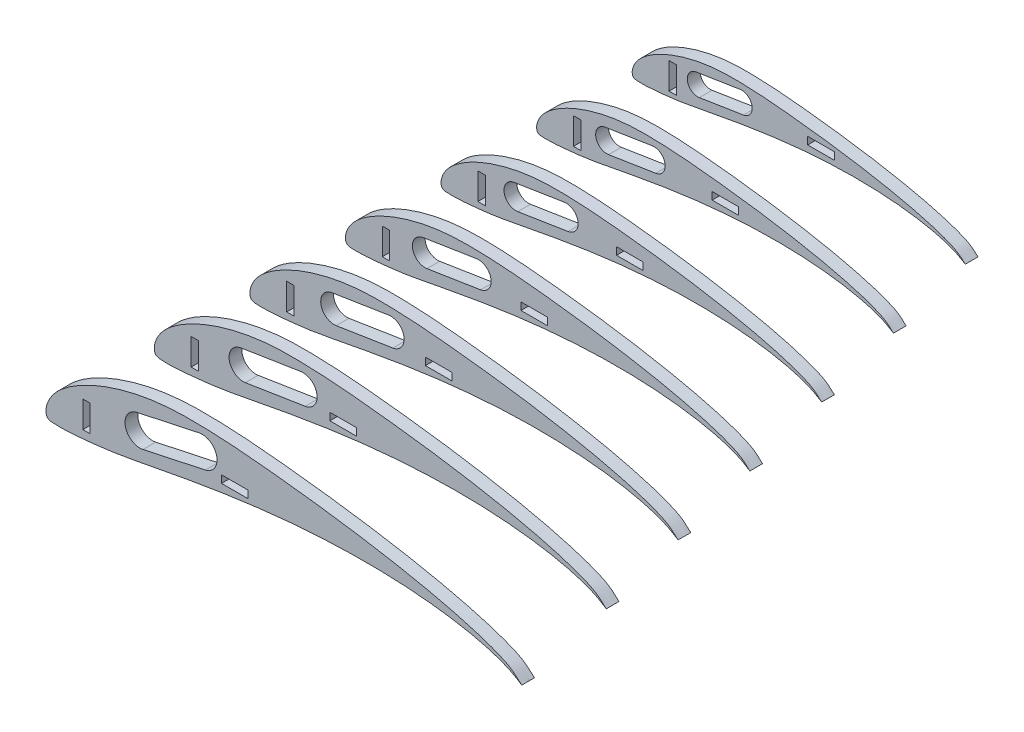
from build123d import *

# Parameters (mm, degrees)
BOSS_EXTRUDE1_DEPTH  = 6
CUT_EXTRUDE1_DEPTH   = 10
BOSS_EXTRUDE8_DEPTH  = 6
BOSS_EXTRUDE9_DEPTH  = 6
BOSS_EXTRUDE10_DEPTH = 6
BOSS_EXTRUDE11_DEPTH = 6
BOSS_EXTRUDE12_DEPTH = 6
BOSS_EXTRUDE13_DEPTH = 6
SKETCH11_W           = 3.5
SKETCH11_H           = 12.5
SKETCH11_W_2         = 12.5
SKETCH11_H_2         = 3.5
CUT_EXTRUDE2_DEPTH   = 362.412187266


with BuildPart() as part:
    # Sketch2 → Boss-Extrude1 (new body)
    with BuildSketch(Plane(origin=(0, 0, 0), x_dir=(0, 1, 0), z_dir=(0, 0, 1))):
        with BuildLine():
            add(Edge.make_bspline(
                [(0, -224), (0.005702412, -224.001341001), (0.554348448, -223.264970695), (1.165388694, -222.642205802), (2.44166658, -221.259416175), (3.799382204, -219.628047718), (5.168110619, -217.396475791), (6.494563188, -214.621499139), (7.878877108, -211.271449243), (9.301777091, -207.351432564), (10.753211404, -202.87973715), (12.220578138, -197.879577131), (13.696990178, -192.37895201), (15.168891242, -186.408233862), (16.625626309, -180.001654372), (18.058096621, -173.197398334), (19.458938187, -166.037015691), (20.810912823, -158.562355663), (22.112088945, -150.820487592), (23.34571141, -142.856028479), (24.514189105, -134.720484688), (25.60826243, -126.465995343), (26.624430408, -118.152347749), (27.56988806, -109.846003212), (28.420779048, -101.615725894), (29.161177978, -93.528566604), (29.749411157, -85.64140381), (30.154040087, -77.999291883), (30.328777712, -70.644746389), (30.310178033, -63.615443619), (29.966002817, -56.924495942), (29.268547246, -50.569311468), (28.282334726, -44.524019662), (27.004705112, -38.787161488), (25.50650617, -33.364630731), (23.814273297, -28.279370788), (21.967579419, -23.553008802), (19.976318444, -19.214914939), (17.880918697, -15.279001261), (15.705208923, -11.76668043), (13.478671875, -8.699978573), (11.2485017, -6.08016101), (8.990354416, -3.945219698), (6.723785626, -2.305312453), (4.518716045, -1.093954275), (2.42510695, -0.317601878), (0.492706389, 0.052330076), (-1.141646455, -0.019076802), (-2.640611366, -0.439847315), (-3.384708529, -2.003918685), (-3.489103018, -4.106833179), (-3.590282567, -6.983612367), (-3.434277467, -10.601365227), (-3.147587635, -14.919204004), (-2.688372693, -19.88907566), (-2.067035131, -25.460124636), (-1.270242167, -31.605185034), (-0.15660544, -38.321253852), (1.239876963, -45.641031053), (2.759695447, -53.601110597), (4.364405875, -62.162584264), (5.98740184, -71.271676995), (7.567774206, -80.861491288), (9.052750205, -90.857628696), (10.387855574, -101.173942968), (11.534215269, -111.717662379), (12.440365405, -122.389187836), (13.082714119, -133.081427951), (13.435848787, -143.682676261), (13.480452226, -154.077927826), (13.21349384, -164.151207334), (12.641223178, -173.787169766), (11.771024072, -182.869944039), (10.636299016, -191.291394287), (9.269973456, -198.941875925), (7.717807326, -205.731690442), (6.056920419, -211.535704676), (4.284278527, -216.285691763), (2.662084252, -219.674685277), (1.162148937, -222.173299724), (0.581698714, -223.13315995), (-0.005818341, -223.998631736), (0, -224)],
                knots=[0, 0, 0, 0, 0.000979678, 0.003648862, 0.007483499, 0.012095277, 0.017525591, 0.02405178, 0.031783051, 0.040677828, 0.050710301, 0.061833229, 0.07398925, 0.087118173, 0.101145049, 0.115990637, 0.131570422, 0.147788379, 0.164550917, 0.181757895, 0.199311955, 0.217095072, 0.234990228, 0.252856883, 0.270540594, 0.287886779, 0.304773438, 0.321101419, 0.336806063, 0.351800033, 0.366031063, 0.379615675, 0.392652963, 0.405170359, 0.417171919, 0.428603517, 0.439418959, 0.449596586, 0.459102079, 0.467907878, 0.475988301, 0.483308969, 0.489874508, 0.49580325, 0.501149412, 0.505903073, 0.510046769, 0.513579311, 0.516446927, 0.519350053, 0.523823355, 0.529973794, 0.537715654, 0.546967844, 0.557637367, 0.569620481, 0.582804124, 0.597246961, 0.613135037, 0.6304436, 0.649056124, 0.668822257, 0.689594964, 0.711189651, 0.733426689, 0.756094118, 0.778988554, 0.801889683, 0.824566598, 0.846792285, 0.868338291, 0.888978163, 0.908492011, 0.926658768, 0.943286193, 0.95816921, 0.971135822, 0.981955623, 0.990251791, 0.995852565, 0.999000406, 1, 1, 1, 1], degree=3))
        make_face()
    extrude(amount=BOSS_EXTRUDE1_DEPTH)

    # Sketch3 → Cut-Extrude1 (cut)
    with BuildSketch(Plane(origin=(0, 0, 0), x_dir=(1, 0, 0), z_dir=(0, 0, -1))):
        with BuildLine():
            Line((45.664943608, -6.8980064), (74.995985185, -13.1980064))
            ThreePointArc((74.995985185, -13.1980064), (80.369894886, -21.511916101), (72.055985185, -26.885825803))
            Line((72.055985185, -26.885825803), (42.724943608, -20.585825803))
            ThreePointArc((42.724943608, -20.585825803), (37.351033906, -12.271916101), (45.664943608, -6.8980064))
        make_face()
    extrude(amount=-CUT_EXTRUDE1_DEPTH, mode=Mode.SUBTRACT)


with BuildPart() as body_2:
    # Sketch5 → Boss-Extrude8 (new body)
    with BuildSketch(Plane(origin=(0, 0, -45), x_dir=(-1, 0, 0), z_dir=(0, 0, -1))):
        with BuildLine():
            add(Edge.make_bspline(
                [(-212.8, 0), (-212.79870015, -0.005527424), (-211.976501953, 0.552613778), (-211.064634738, 1.10404149), (-208.690951013, 2.528980039), (-205.471407175, 4.0700646), (-200.958919443, 5.754074398), (-195.44510592, 7.33191696), (-188.994782128, 8.806474783), (-181.726824573, 10.104484065), (-173.726446837, 11.182472868), (-165.097811278, 12.009162019), (-155.943646967, 12.552819148), (-146.374031435, 12.806429614), (-136.498542448, 12.764056347), (-126.427356553, 12.428578413), (-116.269728444, 11.818347135), (-106.13177926, 10.957504505), (-96.115245819, 9.868462796), (-86.314747261, 8.600112694), (-76.818416723, 7.189385496), (-67.708093146, 5.688031748), (-59.054455051, 4.146185582), (-50.921055067, 2.621710675), (-43.3589795, 1.177883115), (-36.405191159, -0.148775168), (-30.024925782, -1.206730058), (-24.187118405, -1.963683374), (-18.894621877, -2.553954058), (-14.173243804, -2.990208253), (-10.071296965, -3.262563593), (-6.634431749, -3.410768438), (-3.90149152, -3.314647867), (-1.90372275, -3.215473103), (-0.417854949, -2.508580798), (-0.018122962, -1.084564133), (0.049713573, 0.46807107), (-0.301721784, 2.303851603), (-1.039256561, 4.292780243), (-2.190046831, 6.387596345), (-3.747958713, 8.540836695), (-5.77615296, 10.686076615), (-8.264979645, 12.804738281), (-11.178346408, 14.919948477), (-14.515051198, 16.986872762), (-18.254169192, 18.977502521), (-22.375358362, 20.869200448), (-26.865402249, 22.623559632), (-31.696399194, 24.231180862), (-36.847803413, 25.654469857), (-42.297818679, 26.86821799), (-48.040845894, 27.805119884), (-54.078271145, 28.467702677), (-60.434671438, 28.794669132), (-67.11250907, 28.812338826), (-74.099327289, 28.646338083), (-81.359333619, 28.261940599), (-88.852138273, 27.703119079), (-96.534939599, 26.999740095), (-104.353703051, 26.191393657), (-112.244730361, 25.293208887), (-120.142695576, 24.327849308), (-127.984460453, 23.28847965), (-135.713227055, 22.178425839), (-143.279463212, 21.006484498), (-150.63423788, 19.770367182), (-157.735164906, 18.485991277), (-164.537528417, 17.15519179), (-171.001571654, 15.794344994), (-177.087822169, 14.41044668), (-182.76000441, 13.012140669), (-187.985598274, 11.609549231), (-192.735750292, 10.215550833), (-196.983860936, 8.836688236), (-200.707876781, 7.484933253), (-203.890424182, 6.169835028), (-206.526652002, 4.909705088), (-208.646645332, 3.609413094), (-210.196445366, 2.319583251), (-211.510095512, 1.107119259), (-212.10172216, 0.526631026), (-212.801273951, 0.005417291), (-212.8, 0)],
                knots=[0, 0, 0, 0, 0.000999594, 0.004147435, 0.009748209, 0.018044377, 0.028864178, 0.04183079, 0.056713807, 0.073341232, 0.091507989, 0.111021837, 0.131661709, 0.153207715, 0.175433402, 0.198110317, 0.221011446, 0.243905882, 0.266573311, 0.288810349, 0.310405036, 0.331177743, 0.350943876, 0.3695564, 0.386864963, 0.402753039, 0.417195876, 0.430379519, 0.442362633, 0.453032156, 0.462284346, 0.470026206, 0.476176645, 0.480649947, 0.483553073, 0.486420689, 0.489953231, 0.494096927, 0.498850588, 0.50419675, 0.510125492, 0.516691031, 0.524011699, 0.532092122, 0.540897921, 0.550403414, 0.560581041, 0.571396483, 0.582828081, 0.594829641, 0.607347037, 0.620384325, 0.633968937, 0.648199967, 0.663193937, 0.678898581, 0.695226562, 0.712113221, 0.729459406, 0.747143117, 0.765009772, 0.782904928, 0.800688045, 0.818242105, 0.835449083, 0.852211621, 0.868429578, 0.884009363, 0.898854951, 0.912881827, 0.92601075, 0.938166771, 0.949289699, 0.959322172, 0.968216949, 0.97594822, 0.982474409, 0.987904723, 0.992516501, 0.996351138, 0.999020322, 1, 1, 1, 1], degree=3))
        make_face()
        with BuildLine():
            Line((-40.804637579, 20.393372232), (-68.955851175, 24.838501372))
            ThreePointArc((-68.955851175, 24.838501372), (-76.56166448, 19.307081666), (-71.030244774, 11.701268361))
            Line((-71.030244774, 11.701268361), (-42.879031178, 7.25613922))
            ThreePointArc((-42.879031178, 7.25613922), (-35.273217873, 12.787558927), (-40.804637579, 20.393372232))
        make_face(mode=Mode.SUBTRACT)
    extrude(amount=BOSS_EXTRUDE8_DEPTH)


with BuildPart() as body_3:
    # Sketch6 → Boss-Extrude9 (new body)
    with BuildSketch(Plane(origin=(0, 0, -90), x_dir=(-1, 0, 0), z_dir=(0, 0, -1))):
        with BuildLine():
            add(Edge.make_bspline(
                [(-201.6, 0), (-201.598768563, -0.005236507), (-200.819843955, 0.523528843), (-199.955969751, 1.045934044), (-197.707216749, 2.395875827), (-194.657122586, 3.855850674), (-190.382134209, 5.451228377), (-185.158521398, 6.946026594), (-179.047688332, 8.34297611), (-172.162254859, 9.572669115), (-164.582949635, 10.593921664), (-156.408452789, 11.37710086), (-147.7360866, 11.892144456), (-138.670135043, 12.132407003), (-129.314408635, 12.092263908), (-119.773285155, 11.774442707), (-110.150269052, 11.196328865), (-100.545896141, 10.380793742), (-91.056548671, 9.349070017), (-81.771865826, 8.147475184), (-72.775342159, 6.810996786), (-64.144509296, 5.388661656), (-55.946325838, 3.927965288), (-48.240999537, 2.483725902), (-41.076927948, 1.115889267), (-34.489128466, -0.140944896), (-28.44466653, -1.14321795), (-22.914112173, -1.860331618), (-17.900168094, -2.419535423), (-13.427283603, -2.832828872), (-9.541228704, -3.09084972), (-6.285251131, -3.23125431), (-3.696149861, -3.140192716), (-1.803526816, -3.046237676), (-0.395862583, -2.37655023), (-0.017169122, -1.02748181), (0.047097069, 0.44343575), (-0.28584169, 2.182596255), (-0.984558847, 4.06684444), (-2.074781208, 6.051407064), (-3.550697728, 8.091318975), (-5.472144909, 10.12365153), (-7.829980716, 12.130804687), (-10.590012387, 14.134688031), (-13.751101135, 16.092826828), (-17.293423446, 17.978686599), (-21.197707922, 19.770821477), (-25.451433709, 21.432845967), (-30.028167658, 22.955855553), (-34.908445339, 24.304234601), (-40.071617695, 25.454101254), (-45.512380321, 26.341692522), (-51.232046348, 26.969402536), (-57.253899257, 27.27916023), (-63.58027175, 27.295899941), (-70.199362695, 27.138636078), (-77.077263429, 26.774470041), (-84.175709943, 26.245060181), (-91.454153304, 25.578701143), (-98.861402891, 24.812899254), (-106.337112974, 23.961987367), (-113.819395809, 23.047436187), (-121.248436219, 22.062770195), (-128.570425631, 21.011140269), (-135.738438833, 19.900880051), (-142.706120097, 18.72982154), (-149.433314122, 17.513044368), (-155.877658501, 16.252286959), (-162.001488935, 14.963063678), (-167.767410476, 13.652002118), (-173.141056809, 12.32729116), (-178.091619418, 10.998520324), (-182.591763435, 9.677890263), (-186.616289308, 8.371599382), (-190.144304319, 7.090989397), (-193.159349225, 5.845106869), (-195.656828212, 4.651299557), (-197.665242946, 3.419443984), (-199.133474557, 2.197499922), (-200.377985222, 1.048849825), (-200.938473626, 0.498913603), (-201.601206901, 0.005132171), (-201.6, 0)],
                knots=[0, 0, 0, 0, 0.000999594, 0.004147435, 0.009748209, 0.018044377, 0.028864178, 0.04183079, 0.056713807, 0.073341232, 0.091507989, 0.111021837, 0.131661709, 0.153207715, 0.175433402, 0.198110317, 0.221011446, 0.243905882, 0.266573311, 0.288810349, 0.310405036, 0.331177743, 0.350943876, 0.3695564, 0.386864963, 0.402753039, 0.417195876, 0.430379519, 0.442362633, 0.453032156, 0.462284346, 0.470026206, 0.476176645, 0.480649947, 0.483553073, 0.486420689, 0.489953231, 0.494096927, 0.498850588, 0.50419675, 0.510125492, 0.516691031, 0.524011699, 0.532092122, 0.540897921, 0.550403414, 0.560581041, 0.571396483, 0.582828081, 0.594829641, 0.607347037, 0.620384325, 0.633968937, 0.648199967, 0.663193937, 0.678898581, 0.695226562, 0.712113221, 0.729459406, 0.747143117, 0.765009772, 0.782904928, 0.800688045, 0.818242105, 0.835449083, 0.852211621, 0.868429578, 0.884009363, 0.898854951, 0.912881827, 0.92601075, 0.938166771, 0.949289699, 0.959322172, 0.968216949, 0.97594822, 0.982474409, 0.987904723, 0.992516501, 0.996351138, 0.999020322, 1, 1, 1, 1], degree=3))
        make_face()
        with BuildLine():
            Line((-38.657025075, 19.320036851), (-65.32659585, 23.531211826))
            ThreePointArc((-65.32659585, 23.531211826), (-72.532103192, 18.290919473), (-67.291810839, 11.085412131))
            Line((-67.291810839, 11.085412131), (-40.622240063, 6.874237156))
            ThreePointArc((-40.622240063, 6.874237156), (-33.416732722, 12.114529509), (-38.657025075, 19.320036851))
        make_face(mode=Mode.SUBTRACT)
    extrude(amount=BOSS_EXTRUDE9_DEPTH)


with BuildPart() as body_4:
    # Sketch7 → Boss-Extrude10 (new body)
    with BuildSketch(Plane(origin=(0, 0, -135), x_dir=(-1, 0, 0), z_dir=(0, 0, -1))):
        with BuildLine():
            add(Edge.make_bspline(
                [(-190.4, 0), (-190.398836976, -0.00494559), (-189.663185958, 0.494443907), (-188.847304765, 0.987826597), (-186.723482486, 2.262771614), (-183.842837998, 3.641636748), (-179.805348975, 5.148382356), (-174.871936876, 6.560136228), (-169.100594536, 7.879477437), (-162.597685144, 9.040854164), (-155.439452433, 10.005370461), (-147.719094301, 10.745039701), (-139.528526234, 11.231469764), (-130.966238652, 11.458384392), (-122.130274822, 11.420471469), (-113.119213758, 11.120307001), (-104.03080966, 10.574310595), (-94.960013022, 9.804082978), (-85.997851523, 8.829677238), (-77.228984391, 7.694837674), (-68.732267595, 6.432608075), (-60.580925446, 5.089291564), (-52.838196625, 3.709744994), (-45.560944008, 2.34574113), (-38.794876395, 1.053895418), (-32.573065774, -0.133114624), (-26.864407279, -1.079705842), (-21.641105941, -1.756979861), (-16.905714311, -2.285116789), (-12.681323403, -2.67544949), (-9.011160443, -2.919135847), (-5.936070512, -3.051740182), (-3.490808202, -2.965737565), (-1.703330882, -2.87700225), (-0.373870217, -2.244519661), (-0.016215282, -0.970399487), (0.044480565, 0.418800431), (-0.269961596, 2.061340908), (-0.929861134, 3.840908638), (-1.959515585, 5.715217782), (-3.353436743, 7.641801254), (-5.168136859, 9.561226445), (-7.394981787, 11.456871094), (-10.001678365, 13.349427584), (-12.987151072, 15.198780893), (-16.332677699, 16.979870677), (-20.020057482, 18.672442506), (-24.03746517, 20.242132302), (-28.359936121, 21.680530245), (-32.969087264, 22.953999346), (-37.845416712, 24.039984517), (-42.983914747, 24.878265159), (-48.385821551, 25.471102395), (-54.073127076, 25.763651328), (-60.048034431, 25.779461055), (-66.2993981, 25.630934074), (-72.795193238, 25.286999483), (-79.499281613, 24.787001282), (-86.37336701, 24.15766219), (-93.36910273, 23.434404851), (-100.429495586, 22.630765847), (-107.496096041, 21.767023065), (-114.512411985, 20.83706074), (-121.427624207, 19.843854698), (-128.197414453, 18.795275603), (-134.778002314, 17.689275899), (-141.131463337, 16.540097459), (-147.217788584, 15.349382128), (-153.001406217, 14.131782363), (-158.446998783, 12.893557556), (-163.522109209, 11.642441651), (-168.197640561, 10.387491417), (-172.447776577, 9.140229693), (-176.24871768, 7.906510527), (-179.580731857, 6.697045542), (-182.428274268, 5.520378709), (-184.787004422, 4.392894026), (-186.68384056, 3.229474874), (-188.070503749, 2.075416593), (-189.245874932, 0.99058039), (-189.775225091, 0.471196181), (-190.401139851, 0.00484705), (-190.4, 0)],
                knots=[0, 0, 0, 0, 0.000999594, 0.004147435, 0.009748209, 0.018044377, 0.028864178, 0.04183079, 0.056713807, 0.073341232, 0.091507989, 0.111021837, 0.131661709, 0.153207715, 0.175433402, 0.198110317, 0.221011446, 0.243905882, 0.266573311, 0.288810349, 0.310405036, 0.331177743, 0.350943876, 0.3695564, 0.386864963, 0.402753039, 0.417195876, 0.430379519, 0.442362633, 0.453032156, 0.462284346, 0.470026206, 0.476176645, 0.480649947, 0.483553073, 0.486420689, 0.489953231, 0.494096927, 0.498850588, 0.50419675, 0.510125492, 0.516691031, 0.524011699, 0.532092122, 0.540897921, 0.550403414, 0.560581041, 0.571396483, 0.582828081, 0.594829641, 0.607347037, 0.620384325, 0.633968937, 0.648199967, 0.663193937, 0.678898581, 0.695226562, 0.712113221, 0.729459406, 0.747143117, 0.765009772, 0.782904928, 0.800688045, 0.818242105, 0.835449083, 0.852211621, 0.868429578, 0.884009363, 0.898854951, 0.912881827, 0.92601075, 0.938166771, 0.949289699, 0.959322172, 0.968216949, 0.97594822, 0.982474409, 0.987904723, 0.992516501, 0.996351138, 0.999020322, 1, 1, 1, 1], degree=3))
        make_face()
        with BuildLine():
            Line((-36.509412571, 18.24670147), (-61.697340525, 22.22392228))
            ThreePointArc((-61.697340525, 22.22392228), (-68.502541903, 17.27475728), (-63.553376903, 10.469555902))
            Line((-63.553376903, 10.469555902), (-38.365448949, 6.492335092))
            ThreePointArc((-38.365448949, 6.492335092), (-31.56024757, 11.441500092), (-36.509412571, 18.24670147))
        make_face(mode=Mode.SUBTRACT)
    extrude(amount=BOSS_EXTRUDE10_DEPTH)


with BuildPart() as body_5:
    # Sketch8 → Boss-Extrude11 (new body)
    with BuildSketch(Plane(origin=(0, 0, -180), x_dir=(-1, 0, 0), z_dir=(0, 0, -1))):
        with BuildLine():
            add(Edge.make_bspline(
                [(-179.2, 0), (-179.198905389, -0.004654673), (-178.50652796, 0.465358971), (-177.738639779, 0.92971915), (-175.739748222, 2.129667402), (-173.02855341, 3.427422821), (-169.228563741, 4.845536335), (-164.585352354, 6.174245861), (-159.15350074, 7.415978765), (-153.03311543, 8.509039213), (-146.295955231, 9.416819257), (-139.029735813, 10.112978542), (-131.320965867, 10.570795072), (-123.262342261, 10.78436178), (-114.946141009, 10.748679029), (-106.46514236, 10.466171295), (-97.911350268, 9.952292324), (-89.374129903, 9.227372215), (-80.939154374, 8.310284459), (-72.686102957, 7.242200164), (-64.68919303, 6.054219365), (-57.017341596, 4.789921472), (-49.730067411, 3.4915247), (-42.880888478, 2.207756358), (-36.512824842, 0.99190157), (-30.657003081, -0.125284352), (-25.284148027, -1.016193733), (-20.368099709, -1.653628105), (-15.911260528, -2.150698154), (-11.935363203, -2.518070108), (-8.481092181, -2.747421973), (-5.586889894, -2.872226053), (-3.285466543, -2.791282414), (-1.603134948, -2.707766823), (-0.351877852, -2.112489093), (-0.015261442, -0.913317164), (0.041864061, 0.394165111), (-0.254081503, 1.94008556), (-0.87516342, 3.614972836), (-1.844249963, 5.379028501), (-3.156175758, 7.192283533), (-4.864128808, 8.99880136), (-6.959982859, 10.7829375), (-9.413344344, 12.564167138), (-12.223201009, 14.304734958), (-15.371931952, 15.981054755), (-18.842407042, 17.574063535), (-22.623496631, 19.051418638), (-26.691704584, 20.405204936), (-31.02972919, 21.60376409), (-35.619215729, 22.625867781), (-40.455449174, 23.414837797), (-45.539596754, 23.972802254), (-50.892354895, 24.248142427), (-56.515797111, 24.26302217), (-62.399433506, 24.12323207), (-68.513123048, 23.799528926), (-74.822853283, 23.328942383), (-81.292580715, 22.736623238), (-87.87680257, 22.055910448), (-94.521878199, 21.299544326), (-101.172796274, 20.486609944), (-107.77638775, 19.611351284), (-114.284822783, 18.676569128), (-120.656390074, 17.689671156), (-126.849884531, 16.648730258), (-132.829612552, 15.567150549), (-138.557918667, 14.446477297), (-144.001323498, 13.300501047), (-149.12658709, 12.135112994), (-153.903161608, 10.957592142), (-158.303661705, 9.77646251), (-162.30378972, 8.602569123), (-165.881146051, 7.441421672), (-169.017159395, 6.303101686), (-171.697199311, 5.19565055), (-173.917180633, 4.134488495), (-175.702438174, 3.039505764), (-177.00753294, 1.953333264), (-178.113764642, 0.932310955), (-178.611976556, 0.443478758), (-179.201072801, 0.004561929), (-179.2, 0)],
                knots=[0, 0, 0, 0, 0.000999594, 0.004147435, 0.009748209, 0.018044377, 0.028864178, 0.04183079, 0.056713807, 0.073341232, 0.091507989, 0.111021837, 0.131661709, 0.153207715, 0.175433402, 0.198110317, 0.221011446, 0.243905882, 0.266573311, 0.288810349, 0.310405036, 0.331177743, 0.350943876, 0.3695564, 0.386864963, 0.402753039, 0.417195876, 0.430379519, 0.442362633, 0.453032156, 0.462284346, 0.470026206, 0.476176645, 0.480649947, 0.483553073, 0.486420689, 0.489953231, 0.494096927, 0.498850588, 0.50419675, 0.510125492, 0.516691031, 0.524011699, 0.532092122, 0.540897921, 0.550403414, 0.560581041, 0.571396483, 0.582828081, 0.594829641, 0.607347037, 0.620384325, 0.633968937, 0.648199967, 0.663193937, 0.678898581, 0.695226562, 0.712113221, 0.729459406, 0.747143117, 0.765009772, 0.782904928, 0.800688045, 0.818242105, 0.835449083, 0.852211621, 0.868429578, 0.884009363, 0.898854951, 0.912881827, 0.92601075, 0.938166771, 0.949289699, 0.959322172, 0.968216949, 0.97594822, 0.982474409, 0.987904723, 0.992516501, 0.996351138, 0.999020322, 1, 1, 1, 1], degree=3))
        make_face()
        with BuildLine():
            Line((-34.361800067, 17.17336609), (-58.0680852, 20.916632734))
            ThreePointArc((-58.0680852, 20.916632734), (-64.472980615, 16.258595087), (-59.814942968, 9.853699672))
            Line((-59.814942968, 9.853699672), (-36.108657834, 6.110433028))
            ThreePointArc((-36.108657834, 6.110433028), (-29.703762419, 10.768470675), (-34.361800067, 17.17336609))
        make_face(mode=Mode.SUBTRACT)
    extrude(amount=BOSS_EXTRUDE11_DEPTH)


with BuildPart() as body_6:
    # Sketch9 → Boss-Extrude12 (new body)
    with BuildSketch(Plane(origin=(0, 0, -225), x_dir=(-1, 0, 0), z_dir=(0, 0, -1))):
        with BuildLine():
            add(Edge.make_bspline(
                [(-168, 0), (-167.998973802, -0.004363756), (-167.349869963, 0.436274036), (-166.629974793, 0.871611703), (-164.756013958, 1.996563189), (-162.214268822, 3.213208895), (-158.651778507, 4.542690314), (-154.298767831, 5.788355495), (-149.206406944, 6.952480092), (-143.468545715, 7.977224262), (-137.152458029, 8.828268054), (-130.340377324, 9.480917383), (-123.1134055, 9.91012038), (-115.55844587, 10.110339169), (-107.762007196, 10.07688659), (-99.811070963, 9.812035589), (-91.791890877, 9.330274054), (-83.788246784, 8.650661451), (-75.880457226, 7.790891681), (-68.143221522, 6.789562653), (-60.646118466, 5.675830655), (-53.453757747, 4.49055138), (-46.621938198, 3.273304407), (-40.200832948, 2.069771585), (-34.23077329, 0.929907722), (-28.740940389, -0.11745408), (-23.703888775, -0.952681625), (-19.095093477, -1.550276348), (-14.916806745, -2.016279519), (-11.189403003, -2.360690726), (-7.95102392, -2.5757081), (-5.237709275, -2.692711925), (-3.080124884, -2.616827263), (-1.502939013, -2.538531397), (-0.329885486, -1.980458525), (-0.014307602, -0.856234841), (0.039247557, 0.369529792), (-0.238201409, 1.818830213), (-0.820465706, 3.389037034), (-1.72898434, 5.04283922), (-2.958914773, 6.742765812), (-4.560120758, 8.436376275), (-6.52498393, 10.109003906), (-8.825010322, 11.778906692), (-11.459250946, 13.410689023), (-14.411186205, 14.982238833), (-17.664756602, 16.475684564), (-21.209528091, 17.860704973), (-25.023473048, 19.129879628), (-29.090371116, 20.253528834), (-33.393014746, 21.211751045), (-37.926983601, 21.951410435), (-42.693371956, 22.474502113), (-47.711582714, 22.732633525), (-52.983559792, 22.746583284), (-58.499468912, 22.615530065), (-64.231052857, 22.312058368), (-70.146424953, 21.870883484), (-76.21179442, 21.315584286), (-82.384502409, 20.677416045), (-88.614260812, 19.968322806), (-94.849496507, 19.206196822), (-101.040363516, 18.385641829), (-107.142021359, 17.509283557), (-113.115365694, 16.584066709), (-118.921766747, 15.608184617), (-124.527761768, 14.59420364), (-129.898048751, 13.543572466), (-135.001240779, 12.469219732), (-139.806175397, 11.376668432), (-144.284214008, 10.272742633), (-148.409682848, 9.165433603), (-152.159802862, 8.064908553), (-155.513574423, 6.976332818), (-158.453586933, 5.909157831), (-160.966124354, 4.870922391), (-163.047356843, 3.876082964), (-164.721035788, 2.849536653), (-165.944562131, 1.831249935), (-166.981654352, 0.87404152), (-167.448728021, 0.415761336), (-168.001005751, 0.004276809), (-168, 0)],
                knots=[0, 0, 0, 0, 0.000999594, 0.004147435, 0.009748209, 0.018044377, 0.028864178, 0.04183079, 0.056713807, 0.073341232, 0.091507989, 0.111021837, 0.131661709, 0.153207715, 0.175433402, 0.198110317, 0.221011446, 0.243905882, 0.266573311, 0.288810349, 0.310405036, 0.331177743, 0.350943876, 0.3695564, 0.386864963, 0.402753039, 0.417195876, 0.430379519, 0.442362633, 0.453032156, 0.462284346, 0.470026206, 0.476176645, 0.480649947, 0.483553073, 0.486420689, 0.489953231, 0.494096927, 0.498850588, 0.50419675, 0.510125492, 0.516691031, 0.524011699, 0.532092122, 0.540897921, 0.550403414, 0.560581041, 0.571396483, 0.582828081, 0.594829641, 0.607347037, 0.620384325, 0.633968937, 0.648199967, 0.663193937, 0.678898581, 0.695226562, 0.712113221, 0.729459406, 0.747143117, 0.765009772, 0.782904928, 0.800688045, 0.818242105, 0.835449083, 0.852211621, 0.868429578, 0.884009363, 0.898854951, 0.912881827, 0.92601075, 0.938166771, 0.949289699, 0.959322172, 0.968216949, 0.97594822, 0.982474409, 0.987904723, 0.992516501, 0.996351138, 0.999020322, 1, 1, 1, 1], degree=3))
        make_face()
        with BuildLine():
            Line((-32.214187563, 16.100030709), (-54.438829875, 19.609343188))
            ThreePointArc((-54.438829875, 19.609343188), (-60.443419327, 15.242432894), (-56.076509032, 9.237843443))
            Line((-56.076509032, 9.237843443), (-33.851866719, 5.728530963))
            ThreePointArc((-33.851866719, 5.728530963), (-27.847277268, 10.095441258), (-32.214187563, 16.100030709))
        make_face(mode=Mode.SUBTRACT)
    extrude(amount=BOSS_EXTRUDE12_DEPTH)


with BuildPart() as body_7:
    # Sketch10 → Boss-Extrude13 (new body)
    with BuildSketch(Plane(origin=(0, 0, -270), x_dir=(-1, 0, 0), z_dir=(0, 0, -1))):
        with BuildLine():
            add(Edge.make_bspline(
                [(-156.8, 0), (-156.799042216, -0.004072839), (-156.193211965, 0.4071891), (-155.521309807, 0.813504256), (-153.772279694, 1.863458976), (-151.399984234, 2.998994969), (-148.074993273, 4.239844293), (-144.012183309, 5.402465129), (-139.259313147, 6.488981419), (-133.903976001, 7.445409311), (-128.008960827, 8.23971685), (-121.651018836, 8.848856224), (-114.905845134, 9.249445688), (-107.854549478, 9.436316558), (-100.577873383, 9.405094151), (-93.156999565, 9.157899883), (-85.672431485, 8.708255784), (-78.202363665, 8.073950688), (-70.821760078, 7.271498902), (-63.600340087, 6.336925143), (-56.603043902, 5.297441944), (-49.890173897, 4.191181288), (-43.513808985, 3.055084113), (-37.520777418, 1.931786813), (-31.948721737, 0.867913874), (-26.824877696, -0.109623808), (-22.123629524, -0.889169517), (-17.822087246, -1.446924592), (-13.922352962, -1.881860885), (-10.443442803, -2.203311345), (-7.420955659, -2.403994227), (-4.888528657, -2.513197797), (-2.874783225, -2.442372112), (-1.402743079, -2.36929597), (-0.30789312, -1.848427956), (-0.013353762, -0.799152519), (0.036631054, 0.344894472), (-0.222321315, 1.697574865), (-0.765767992, 3.163101231), (-1.613718717, 4.706649938), (-2.761653788, 6.293248091), (-4.256112707, 7.87395119), (-6.089985001, 9.435070312), (-8.236676301, 10.993646246), (-10.695300883, 12.516643088), (-13.450440458, 13.983422911), (-16.487106162, 15.377305593), (-19.795559552, 16.669991308), (-23.355241511, 17.854554319), (-27.151013041, 18.903293579), (-31.166813763, 19.797634308), (-35.398518027, 20.487983073), (-39.847147159, 20.976201972), (-44.530810533, 21.217124623), (-49.451322472, 21.230144398), (-54.599504318, 21.107828061), (-59.948982667, 20.82458781), (-65.469996623, 20.412824585), (-71.131008126, 19.894545333), (-76.892202248, 19.298921642), (-82.706643424, 18.637101286), (-88.52619674, 17.925783701), (-94.304339281, 17.159932374), (-99.999219935, 16.341997987), (-105.574341314, 15.478462262), (-110.993648964, 14.567638976), (-116.225910983, 13.621256731), (-121.238178834, 12.640667635), (-126.001158061, 11.637938416), (-130.485763703, 10.61822387), (-134.665266407, 9.587893125), (-138.515703992, 8.554404696), (-142.015816005, 7.527247982), (-145.146002795, 6.511243963), (-147.89001447, 5.515213976), (-150.235049397, 4.546194231), (-152.177533054, 3.617677433), (-153.739633402, 2.659567543), (-154.881591322, 1.709166606), (-155.849544062, 0.815772086), (-156.285479487, 0.388043914), (-156.800938701, 0.003991688), (-156.8, 0)],
                knots=[0, 0, 0, 0, 0.000999594, 0.004147435, 0.009748209, 0.018044377, 0.028864178, 0.04183079, 0.056713807, 0.073341232, 0.091507989, 0.111021837, 0.131661709, 0.153207715, 0.175433402, 0.198110317, 0.221011446, 0.243905882, 0.266573311, 0.288810349, 0.310405036, 0.331177743, 0.350943876, 0.3695564, 0.386864963, 0.402753039, 0.417195876, 0.430379519, 0.442362633, 0.453032156, 0.462284346, 0.470026206, 0.476176645, 0.480649947, 0.483553073, 0.486420689, 0.489953231, 0.494096927, 0.498850588, 0.50419675, 0.510125492, 0.516691031, 0.524011699, 0.532092122, 0.540897921, 0.550403414, 0.560581041, 0.571396483, 0.582828081, 0.594829641, 0.607347037, 0.620384325, 0.633968937, 0.648199967, 0.663193937, 0.678898581, 0.695226562, 0.712113221, 0.729459406, 0.747143117, 0.765009772, 0.782904928, 0.800688045, 0.818242105, 0.835449083, 0.852211621, 0.868429578, 0.884009363, 0.898854951, 0.912881827, 0.92601075, 0.938166771, 0.949289699, 0.959322172, 0.968216949, 0.97594822, 0.982474409, 0.987904723, 0.992516501, 0.996351138, 0.999020322, 1, 1, 1, 1], degree=3))
        make_face()
        with BuildLine():
            Line((-30.066575058, 15.026695329), (-50.80957455, 18.302053643))
            ThreePointArc((-50.80957455, 18.302053643), (-56.413858038, 14.226270701), (-52.338075097, 8.621987213))
            Line((-52.338075097, 8.621987213), (-31.595075605, 5.346628899))
            ThreePointArc((-31.595075605, 5.346628899), (-25.990792117, 9.422411841), (-30.066575058, 15.026695329))
        make_face(mode=Mode.SUBTRACT)
    extrude(amount=BOSS_EXTRUDE13_DEPTH)


with BuildPart() as cut_extrude2_tool:
    # Sketch11 → Cut-Extrude2 (new, through all)
    with BuildSketch(Plane.XY.offset(6)):
        with Locations((19.078069496, 7.093934586)):
            Rectangle(SKETCH11_W, SKETCH11_H)
        with Locations((88.885446067, 13.322749846)):
            Rectangle(SKETCH11_W_2, SKETCH11_H_2)
    extrude(amount=-CUT_EXTRUDE2_DEPTH)


with BuildPart() as part_1:
    add(part.part)

    # Cut-Extrude2: cut by cut_extrude2_tool
    add(cut_extrude2_tool.part, mode=Mode.SUBTRACT)


with BuildPart() as body_2_1:
    add(body_2.part)

    # Cut-Extrude2: cut by cut_extrude2_tool
    add(cut_extrude2_tool.part, mode=Mode.SUBTRACT)


with BuildPart() as body_3_1:
    add(body_3.part)

    # Cut-Extrude2: cut by cut_extrude2_tool
    add(cut_extrude2_tool.part, mode=Mode.SUBTRACT)


with BuildPart() as body_4_1:
    add(body_4.part)

    # Cut-Extrude2: cut by cut_extrude2_tool
    add(cut_extrude2_tool.part, mode=Mode.SUBTRACT)


with BuildPart() as body_5_1:
    add(body_5.part)

    # Cut-Extrude2: cut by cut_extrude2_tool
    add(cut_extrude2_tool.part, mode=Mode.SUBTRACT)


with BuildPart() as body_6_1:
    add(body_6.part)

    # Cut-Extrude2: cut by cut_extrude2_tool
    add(cut_extrude2_tool.part, mode=Mode.SUBTRACT)


with BuildPart() as body_7_1:
    add(body_7.part)

    # Cut-Extrude2: cut by cut_extrude2_tool
    add(cut_extrude2_tool.part, mode=Mode.SUBTRACT)


solid = Compound([part_1.part, body_2_1.part, body_3_1.part, body_4_1.part, body_5_1.part, body_6_1.part, body_7_1.part])
